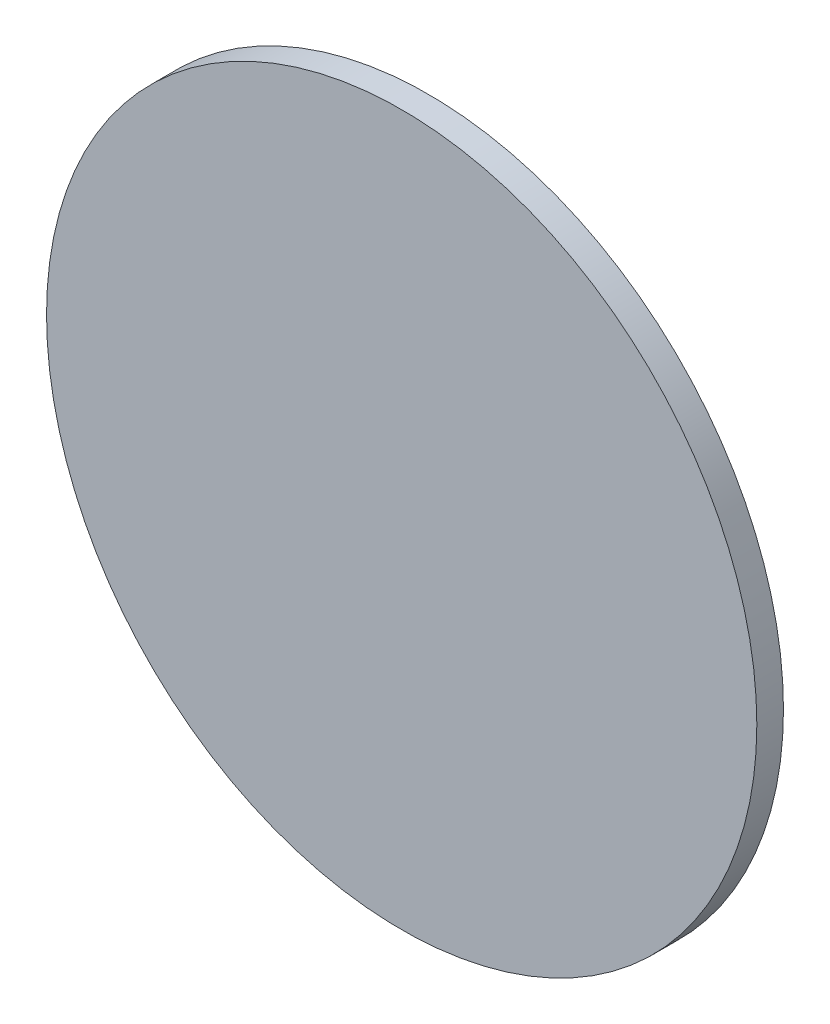
from build123d import *

# Parameters (mm, degrees)
SKETCH1_R           = 4
BOSS_EXTRUDE1_DEPTH = 0.3


with BuildPart() as part:
    # Sketch1 → Boss-Extrude1 (new body)
    with BuildSketch(Plane.XY):
        Circle(SKETCH1_R)
    extrude(amount=-BOSS_EXTRUDE1_DEPTH)


solid = part.part
